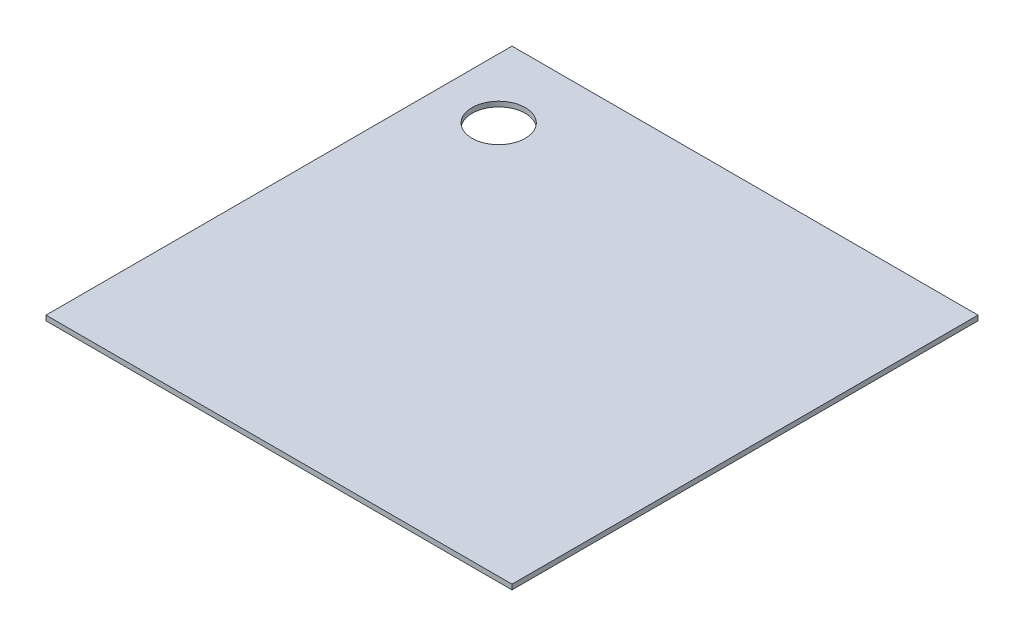
from build123d import *

# Parameters (mm, degrees)
SKETCH1_W           = 280
SKETCH1_H           = 280
SKETCH1_R           = 16
BOSS_EXTRUDE1_DEPTH = 1.5


with BuildPart() as part:
    # Sketch1 → Boss-Extrude1 (new, symmetric)
    with BuildSketch(Plane(origin=(0, 0, 0), x_dir=(1, 0, 0), z_dir=(0, 1, 0))):
        Rectangle(SKETCH1_W, SKETCH1_H)
        with Locations(Location((-104, 96, 0), (0, 0, 270))):
            Circle(SKETCH1_R, mode=Mode.SUBTRACT)
    extrude(amount=BOSS_EXTRUDE1_DEPTH, both=True)


solid = part.part
